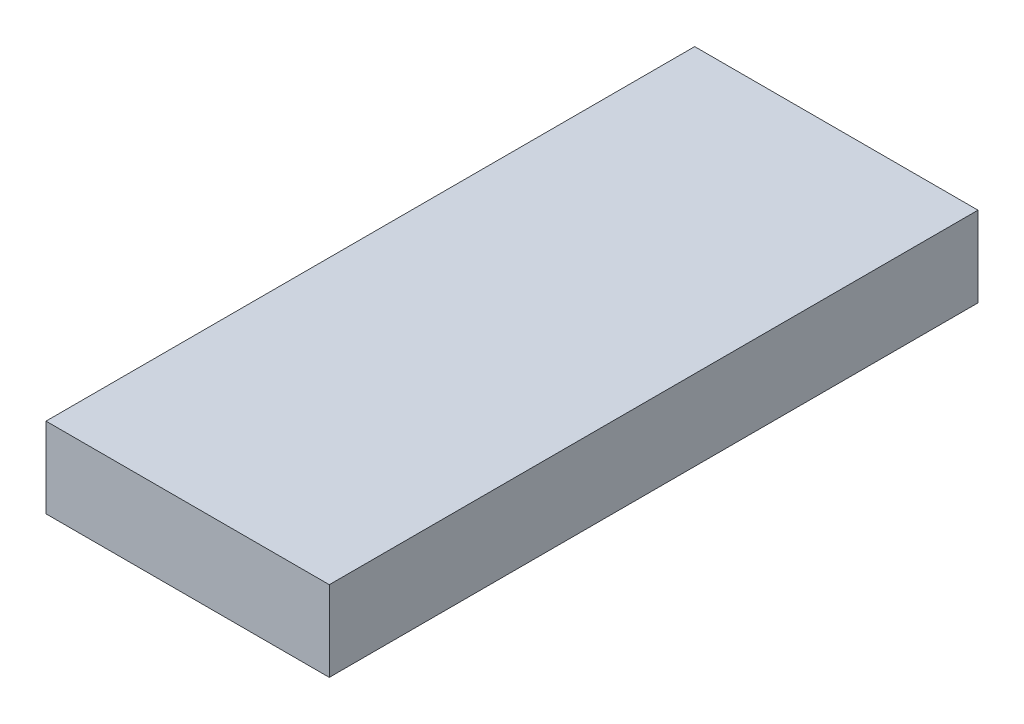
from build123d import *

# Parameters (mm, degrees)
SKETCH1_W               = 63.5
SKETCH1_H               = 145.4
BOSS_EXTRUDE1_DEPTH     = 18
CUT_EXTRUDE2_DEPTH      = 82.347111196
CUT_EXTRUDE2_DEPTH_BACK = 8
SKETCH3_R               = 0.75
SKETCH4_W               = 15
SKETCH4_H               = 5.7
BOSS_EXTRUDE2_DEPTH     = 1


with BuildPart() as part:
    # Sketch1 → Boss-Extrude1 (new body)
    with BuildSketch(Plane(origin=(0, 0, 0), x_dir=(1, 0, 0), z_dir=(0, 1, 0))):
        Rectangle(SKETCH1_W, SKETCH1_H)
    extrude(amount=BOSS_EXTRUDE1_DEPTH)

    # Sketch3 → Cut-Extrude2 (cut, two sides: drawn at the far end of the back side and taken through both)
    with BuildSketch(Plane.XZ.offset(-CUT_EXTRUDE2_DEPTH_BACK)):
        with Locations(Location((10.75, -29.1, 0), (0, 0, 90))):
            Circle(SKETCH3_R)
        with Locations(Location((10.75, -31.64, 0), (0, 0, 90))):
            Circle(SKETCH3_R)
        with Locations(Location((10.75, -34.18, 0), (0, 0, 90))):
            Circle(SKETCH3_R)
        with Locations(Location((10.75, -36.72, 0), (0, 0, 90))):
            Circle(SKETCH3_R)
    extrude(amount=CUT_EXTRUDE2_DEPTH + CUT_EXTRUDE2_DEPTH_BACK, mode=Mode.SUBTRACT)

    # Sketch4 → Boss-Extrude2 (add)
    with BuildSketch(Plane.XZ):
        with Locations((-6.85, -60.25)):
            Rectangle(SKETCH4_W, SKETCH4_H)
    extrude(amount=BOSS_EXTRUDE2_DEPTH)


solid = part.part
